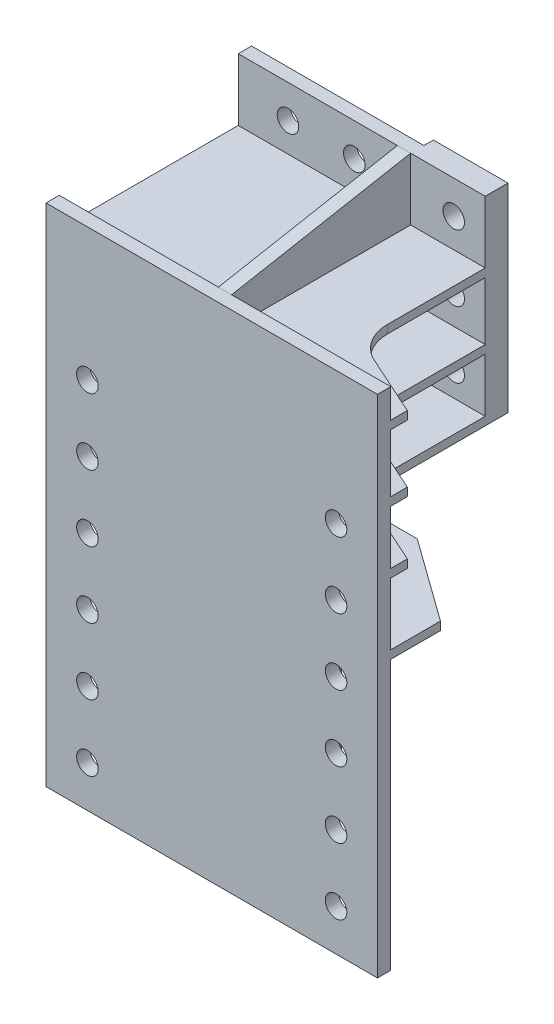
from build123d import *

# Parameters (mm, degrees)
SKETCH_1_W                       = 400
SKETCH_1_H                       = 610
EXTRUDE_1_DEPTH                  = 16
SKETCH_2_R                       = 13
CUT_EXTRUDE_1_DEPTH              = 730.627302121
PATTERN_LINEAR_1_COUNT           = 2
PATTERN_LINEAR_1_PITCH           = 300
PATTERN_LINEAR_1_COUNT_DIR2      = 6
PATTERN_LINEAR_1_PITCH_DIR2      = 80
SKETCH_3_W                       = 16
SKETCH_3_H                       = 650
EXTRUDE_2_DEPTH                  = 216
SKETCH_4_R                       = 13
CUT_EXTRUDE_2_DEPTH              = 721.824527885
SKETCH_5_W                       = 400
SKETCH_5_H                       = 10
EXTRUDE_3_DEPTH                  = 216
CUT_EXTRUDE_3_DEPTH              = 619
SKETCH_7_W                       = 400
SKETCH_7_H                       = 10
EXTRUDE_4_DEPTH                  = 132
CUT_EXTRUDE_4_DEPTH              = 10
SKETCH_9_W                       = 298
SKETCH_9_H                       = 240
EXTRUDE_5_DEPTH                  = 16
SKETCH_10_R                      = 13
CUT_EXTRUDE_5_DEPTH              = 16
PATTERN_LINEAR_2_COUNT           = 2
PATTERN_LINEAR_2_PITCH           = 80
PATTERN_LINEAR_3_COUNT           = 2
PATTERN_LINEAR_3_PITCH           = 200
PATTERN_LINEAR_4_COUNT           = 3
PATTERN_LINEAR_4_PITCH           = 80
PATTERN_LINEAR_4_COPY_1_SKETCH_R = 13
PATTERN_LINEAR_4_COPY_1_DEPTH    = 16
PATTERN_LINEAR_4_COPY_2_SKETCH_R = 13
PATTERN_LINEAR_4_COPY_2_DEPTH    = 16
PATTERN_LINEAR_4_COPY_3_SKETCH_R = 13
PATTERN_LINEAR_4_COPY_3_DEPTH    = 16
PATTERN_LINEAR_4_COPY_4_SKETCH_R = 13
PATTERN_LINEAR_4_COPY_4_DEPTH    = 16
EXTRUDE_START                    = 11.5
SKETCH_12_W                      = 90
SKETCH_12_H                      = 240
SKETCH_12_R                      = 13
EXTRUDE_6_DEPTH                  = 11.5
SKETCH_11_W                      = 259.5
SKETCH_11_H                      = 650
CUT_EXTRUDE_6_DEPTH              = 807.126695998


with BuildPart() as part:
    # 草图1 → 凸台-拉伸1 (new body)
    with BuildSketch(Plane.XY):
        with Locations((200, 305)):
            Rectangle(SKETCH_1_W, SKETCH_1_H)
    extrude(amount=EXTRUDE_1_DEPTH)

    # 草图2 → 切除-拉伸1 (cut, through all)
    with BuildSketch(Plane.XY.offset(16)):
        with Locations((50, 50)):
            Circle(SKETCH_2_R)
    cut_extrude_1 = extrude(amount=-CUT_EXTRUDE_1_DEPTH, mode=Mode.SUBTRACT)

    # 阵列(线性)1: Cut-Extrude 1 2 × 6
    with Locations(*[(i * PATTERN_LINEAR_1_PITCH, j * PATTERN_LINEAR_1_PITCH_DIR2, 0) for i in range(PATTERN_LINEAR_1_COUNT) for j in range(PATTERN_LINEAR_1_COUNT_DIR2) if (i, j) != (0, 0)]):
        add(cut_extrude_1, mode=Mode.SUBTRACT)

    # 草图3 → 凸台-拉伸2 (add)
    with BuildSketch(Plane.XY.offset(16)):
        with Locations((200, 325)):
            Rectangle(SKETCH_3_W, SKETCH_3_H)
    extrude(amount=EXTRUDE_2_DEPTH)

    # 草图4 → 切除-拉伸2 (cut, through all)
    with BuildSketch(Plane(origin=(208, 0, 0), x_dir=(0, 0, -1), z_dir=(1, 0, 0))):
        with Locations((-93.5, 210)):
            Circle(SKETCH_4_R)
        with Locations((-93.5, 130)):
            Circle(SKETCH_4_R)
        with Locations((-93.5, 50)):
            Circle(SKETCH_4_R)
        Polygon((-232, 650), (-16, 650), (-16, 610), align=None)
        with BuildLine():
            Line((-198.5, 410), (-232, 410))
            Line((-232, 410), (-232, 0))
            Line((-232, 0), (-148.5, 0))
            Line((-148.5, 0), (-148.5, 360))
            ThreePointArc((-148.5, 360), (-163.144660941, 395.355339059), (-198.5, 410))
        make_face()
    extrude(amount=-CUT_EXTRUDE_2_DEPTH, mode=Mode.SUBTRACT)

    # 草图5 → 凸台-拉伸3 (add)
    with BuildSketch(Plane.XY.offset(16)):
        with Locations((200, 570)):
            Rectangle(SKETCH_5_W, SKETCH_5_H)
        with Locations((200, 490)):
            Rectangle(SKETCH_5_W, SKETCH_5_H)
        with Locations((200, 415)):
            Rectangle(SKETCH_5_W, SKETCH_5_H)
    extrude(amount=EXTRUDE_3_DEPTH)

    # 草图6 → 切除-拉伸3 (cut, through all)
    with BuildSketch(Plane(origin=(0, 410, 0), x_dir=(-1, 0, 0), z_dir=(0, -1, 0))):
        with BuildLine():
            Line((-298, -232), (-298, -114.300395022))
            ThreePointArc((-298, -114.300395022), (-306.001372744, -87.168950007), (-327.444612345, -68.721057178))
            Line((-327.444612345, -68.721057178), (-400, -36))
            Line((-400, -36), (-400, -232))
            Line((-400, -232), (-298, -232))
        make_face()
    extrude(amount=-CUT_EXTRUDE_3_DEPTH, mode=Mode.SUBTRACT)

    # 草图7 → 凸台-拉伸4 (add)
    with BuildSketch(Plane.XY.offset(16)):
        with Locations((200, 330)):
            Rectangle(SKETCH_7_W, SKETCH_7_H)
    extrude(amount=EXTRUDE_4_DEPTH)

    # 草图8 → 切除-拉伸4 (cut)
    with BuildSketch(Plane(origin=(0, 325, 0), x_dir=(-1, 0, 0), z_dir=(0, -1, 0))):
        Polygon((-400, -148), (-300, -148), (-400, -76), align=None)
        Polygon((0, -148), (-100, -148), (0, -76), align=None)
    extrude(amount=-CUT_EXTRUDE_4_DEPTH, mode=Mode.SUBTRACT)

    # 草图9 → 凸台-拉伸5 (add)
    with BuildSketch(Plane.XY.offset(232)):
        with Locations((149, 530)):
            Rectangle(SKETCH_9_W, SKETCH_9_H)
    extrude(amount=EXTRUDE_5_DEPTH)

    # 草图10 → 切除-拉伸5 (cut)
    with BuildSketch(Plane.XY.offset(248)):
        with Locations((60, 610)):
            Circle(SKETCH_10_R)
    cut_extrude_5 = extrude(amount=-CUT_EXTRUDE_5_DEPTH, mode=Mode.SUBTRACT)

    # 阵列(线性)2: 切除-拉伸5 ×2
    with Locations(*[(i * PATTERN_LINEAR_2_PITCH, 0, 0) for i in range(1, PATTERN_LINEAR_2_COUNT)]):
        add(cut_extrude_5, mode=Mode.SUBTRACT)

    # 阵列(线性)3: 切除-拉伸5 ×2
    with Locations(*[(i * PATTERN_LINEAR_3_PITCH, 0, 0) for i in range(1, PATTERN_LINEAR_3_COUNT)]):
        add(cut_extrude_5, mode=Mode.SUBTRACT)

    # 阵列(线性)4: 切除-拉伸5 ×3
    with Locations(*[(0, -i * PATTERN_LINEAR_4_PITCH, 0) for i in range(1, PATTERN_LINEAR_4_COUNT)]):
        add(cut_extrude_5, mode=Mode.SUBTRACT)

    # 阵列(线性)4 copy 1 sketch → 阵列(线性)4 copy 1 (cut)
    with BuildSketch(Plane(origin=(80, -80, 248), x_dir=(1, 0, 0), z_dir=(0, 0, 1))):
        with Locations((60, 610)):
            Circle(PATTERN_LINEAR_4_COPY_1_SKETCH_R)
    extrude(amount=-PATTERN_LINEAR_4_COPY_1_DEPTH, mode=Mode.SUBTRACT)

    # 阵列(线性)4 copy 2 sketch → 阵列(线性)4 copy 2 (cut)
    with BuildSketch(Plane(origin=(80, -160, 248), x_dir=(1, 0, 0), z_dir=(0, 0, 1))):
        with Locations((60, 610)):
            Circle(PATTERN_LINEAR_4_COPY_2_SKETCH_R)
    extrude(amount=-PATTERN_LINEAR_4_COPY_2_DEPTH, mode=Mode.SUBTRACT)

    # 阵列(线性)4 copy 3 sketch → 阵列(线性)4 copy 3 (cut)
    with BuildSketch(Plane(origin=(200, -80, 248), x_dir=(1, 0, 0), z_dir=(0, 0, 1))):
        with Locations((60, 610)):
            Circle(PATTERN_LINEAR_4_COPY_3_SKETCH_R)
    extrude(amount=-PATTERN_LINEAR_4_COPY_3_DEPTH, mode=Mode.SUBTRACT)

    # 阵列(线性)4 copy 4 sketch → 阵列(线性)4 copy 4 (cut)
    with BuildSketch(Plane(origin=(200, -160, 248), x_dir=(1, 0, 0), z_dir=(0, 0, 1))):
        with Locations((60, 610)):
            Circle(PATTERN_LINEAR_4_COPY_4_SKETCH_R)
    extrude(amount=-PATTERN_LINEAR_4_COPY_4_DEPTH, mode=Mode.SUBTRACT)

    # 草图12 → 凸台-拉伸6 (add)
    with BuildSketch(Plane.XY.offset(248).offset(EXTRUDE_START)):
        with Locations((253, 530)):
            Rectangle(SKETCH_12_W, SKETCH_12_H)
        with Locations((260, 610)):
            Circle(SKETCH_12_R, mode=Mode.SUBTRACT)
        with Locations((260, 530)):
            Circle(SKETCH_12_R, mode=Mode.SUBTRACT)
        with Locations((260, 450)):
            Circle(SKETCH_12_R, mode=Mode.SUBTRACT)
    extrude(amount=-EXTRUDE_6_DEPTH)

    # 镜向1: part across plane


with BuildPart() as part_1:
    add(part.part)
    add(part.part.mirror(Plane.XY))

    # 草图11 → 切除-拉伸6 (cut, through all)
    with BuildSketch(Plane.ZY):
        with Locations((129.75, 325)):
            Rectangle(SKETCH_11_W, SKETCH_11_H)
    extrude(amount=-CUT_EXTRUDE_6_DEPTH, mode=Mode.SUBTRACT)


solid = part_1.part
